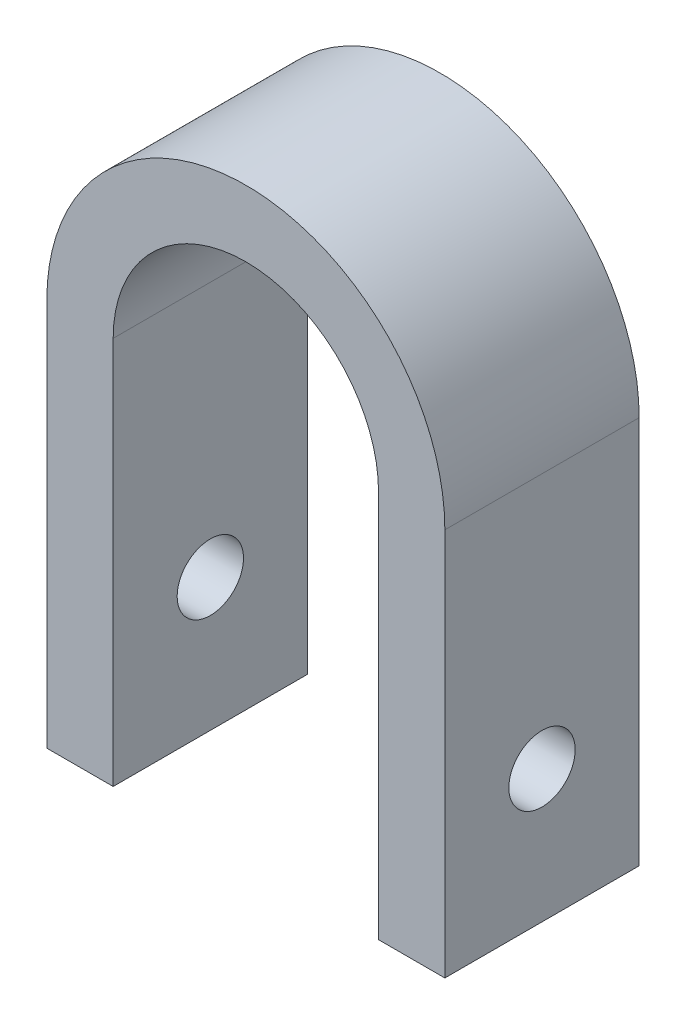
from build123d import *

# Parameters (mm, degrees)
BOSS_EXTRUDE1_DEPTH = 5.85813493
SKETCH2_R           = 1
CUT_EXTRUDE1_DEPTH  = 18.755096263


with BuildPart() as part:
    # Sketch1 → Boss-Extrude1 (new body)
    with BuildSketch(Plane.XY):
        with BuildLine():
            Line((-4, 0), (-4, -11.701525476))
            Line((-4, -11.701525476), (-6, -11.701525476))
            Line((-6, -11.701525476), (-6, 0))
            ThreePointArc((-6, 0), (0, 6), (6, 0))
            Line((6, 0), (6, -11.701525476))
            Line((6, -11.701525476), (3.999999999, -11.701525476))
            Line((3.999999999, -11.701525476), (4, 0))
            ThreePointArc((4, 0), (0, 4), (-4, 0))
        make_face()
    extrude(amount=BOSS_EXTRUDE1_DEPTH)

    # Sketch2 → Cut-Extrude1 (cut, through all)
    with BuildSketch(Plane.ZY.offset(6)):
        with Locations((2.929067465, -7.701525476)):
            Circle(SKETCH2_R)
    extrude(amount=-CUT_EXTRUDE1_DEPTH, mode=Mode.SUBTRACT)


solid = part.part
